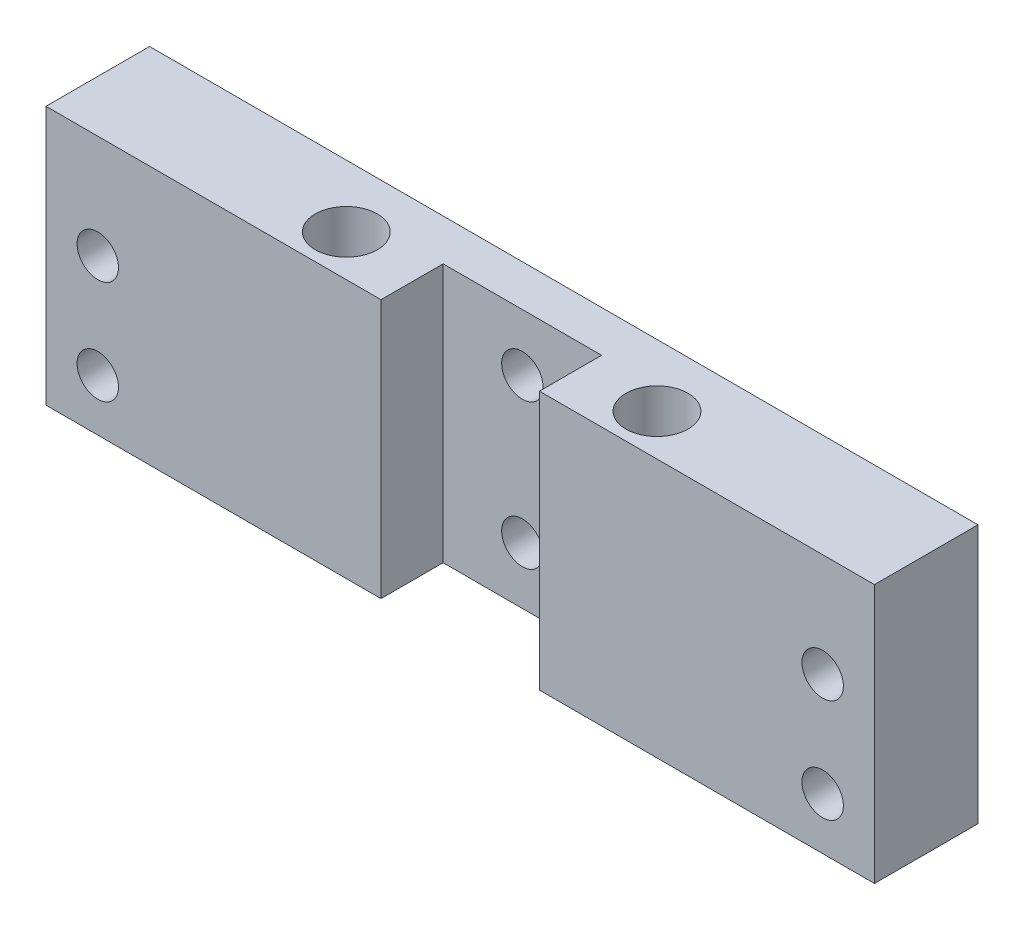
from build123d import *

# Parameters (mm, degrees)
ESQUISSE1_W             = 80
ESQUISSE1_H             = 25
ESQUISSE1_R             = 2
BOSS_EXTRU_1_DEPTH      = 10
ESQUISSE2_W             = 15.3
ESQUISSE2_H             = 25
ENL_V_MAT_EXTRU_1_DEPTH = 6
ESQUISSE3_R             = 3
ENL_V_MAT_EXTRU_2_DEPTH = 15


with BuildPart() as part:
    # Esquisse1 → Boss.-Extru.1 (new body)
    with BuildSketch(Plane.XY):
        with Locations((40, 12.5)):
            Rectangle(ESQUISSE1_W, ESQUISSE1_H)
        with Locations((5, 15)):
            Circle(ESQUISSE1_R, mode=Mode.SUBTRACT)
        with Locations((5, 5)):
            Circle(ESQUISSE1_R, mode=Mode.SUBTRACT)
        with Locations((75, 15)):
            Circle(ESQUISSE1_R, mode=Mode.SUBTRACT)
        with Locations((75, 5)):
            Circle(ESQUISSE1_R, mode=Mode.SUBTRACT)
        with Locations((40, 19.5)):
            Circle(ESQUISSE1_R, mode=Mode.SUBTRACT)
        with Locations((40, 5.5)):
            Circle(ESQUISSE1_R, mode=Mode.SUBTRACT)
    extrude(amount=BOSS_EXTRU_1_DEPTH)

    # Esquisse2 → Enlèv. mat.-Extru.1 (cut)
    with BuildSketch(Plane.XY.offset(10)):
        with Locations((40, 12.5)):
            Rectangle(ESQUISSE2_W, ESQUISSE2_H)
    extrude(amount=-ENL_V_MAT_EXTRU_1_DEPTH, mode=Mode.SUBTRACT)

    # Esquisse3 → Enlèv. mat.-Extru.2 (cut)
    with BuildSketch(Plane(origin=(0, 25, 0), x_dir=(1, 0, 0), z_dir=(0, 1, 0))):
        with Locations(Location((55, -6, 0), (0, 0, 180))):
            Circle(ESQUISSE3_R)
        with Locations(Location((25, -6, 0), (0, 0, 180))):
            Circle(ESQUISSE3_R)
    extrude(amount=-ENL_V_MAT_EXTRU_2_DEPTH, mode=Mode.SUBTRACT)


solid = part.part
